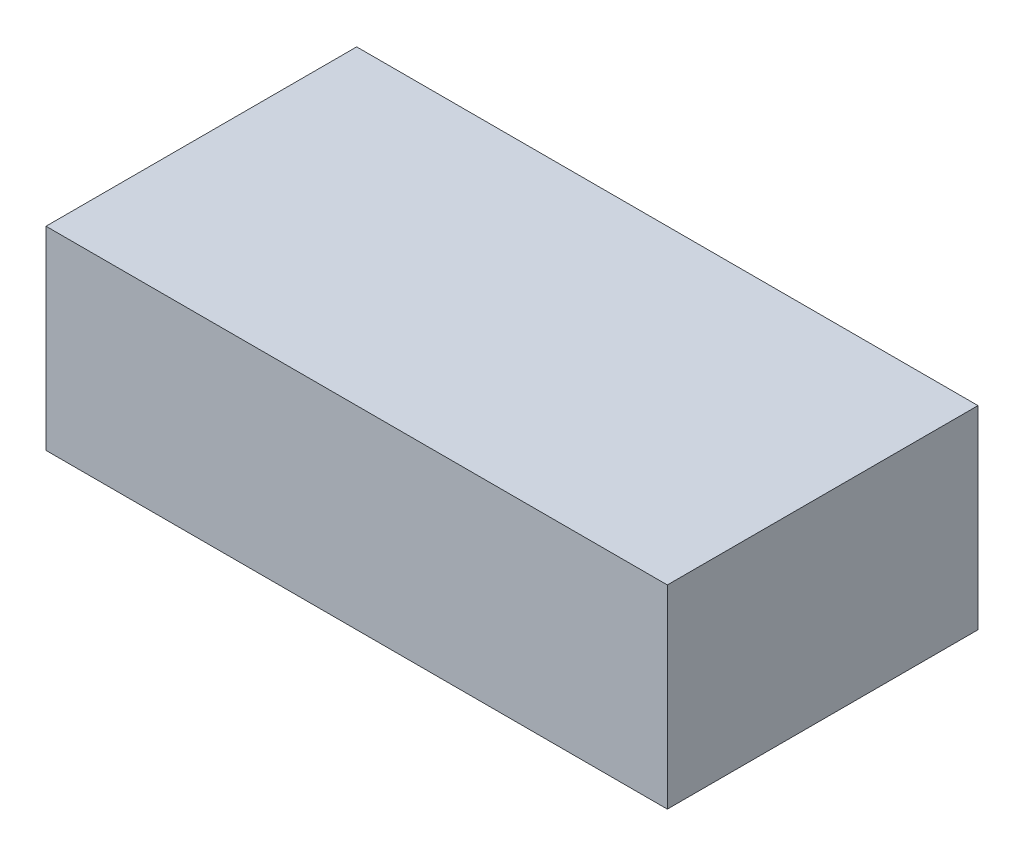
from build123d import *

# Parameters (mm, degrees)
SKETCH1_W           = 101.6
SKETCH1_H           = 50.8
BOSS_EXTRUDE1_DEPTH = 31.75


with BuildPart() as part:
    # Sketch1 → Boss-Extrude1 (new body)
    with BuildSketch(Plane(origin=(0, 0, 0), x_dir=(1, 0, 0), z_dir=(0, 1, 0))):
        with Locations((50.8, 25.4)):
            Rectangle(SKETCH1_W, SKETCH1_H)
    extrude(amount=BOSS_EXTRUDE1_DEPTH)


solid = part.part
